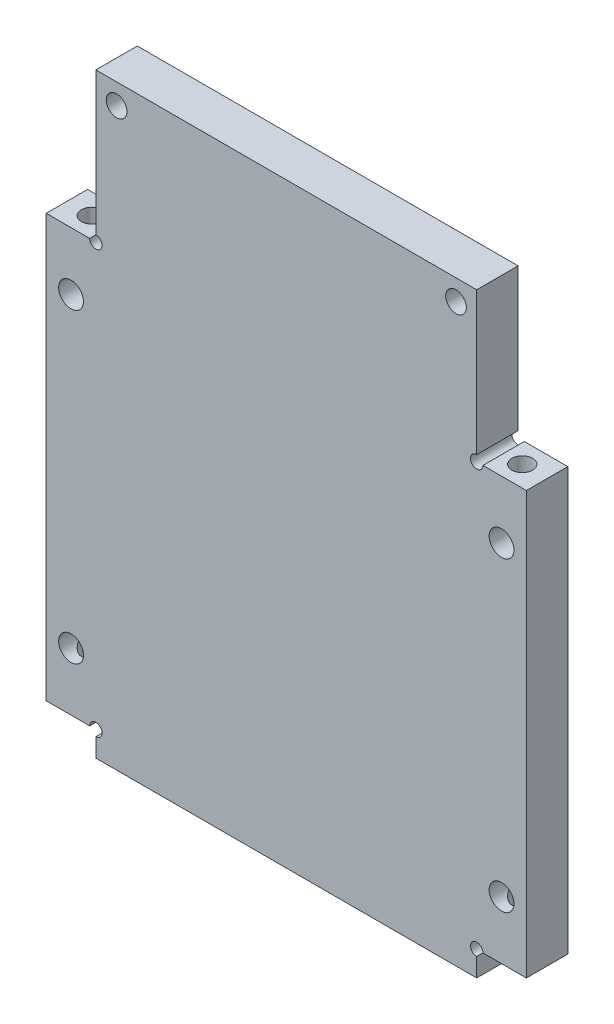
from build123d import *

# Parameters (mm, degrees)
EXTRUDE_1_DEPTH     = 5
SKETCH_3_R          = 1.25
CUT_EXTRUDE_2_DEPTH = 7.5
SKETCH_4_R          = 1.25
CUT_EXTRUDE_3_DEPTH = 76.013332148
SKETCH_5_R          = 0.75
CUT_EXTRUDE_4_DEPTH = 76.013332148
SKETCH_6_R          = 1.5
CUT_EXTRUDE_5_DEPTH = 76.013332148


with BuildPart() as part:
    # ｽｹｯﾁ1 → ﾎﾞｽ - 押し出し1 (new body)
    with BuildSketch(Plane.XY):
        Polygon((-29, 51), (-29, 0), (-23, 0), (-23, -3), (23, -3), (23, 0), (29, 0), (29, 51), (23, 51), (23, 69), (-23, 69), (-23, 51), align=None)
    extrude(amount=EXTRUDE_1_DEPTH)

    # ｽｹｯﾁ3 → ｶｯﾄ - 押し出し2 (cut)
    with BuildSketch(Plane(origin=(0, 51, 0), x_dir=(1, 0, 0), z_dir=(0, 1, 0))):
        with Locations(Location((-26, -2.5, 0), (0, 0, 270))):
            Circle(SKETCH_3_R)
        with Locations(Location((26, -2.5, 0), (0, 0, 270))):
            Circle(SKETCH_3_R)
    cut_extrude_2 = extrude(amount=-CUT_EXTRUDE_2_DEPTH, mode=Mode.SUBTRACT)

    # ﾐﾗｰ1: ｶｯﾄ - 押し出し2 across plane
    add(cut_extrude_2.mirror(Plane.ZX.offset(25.5)), mode=Mode.SUBTRACT)

    # ｽｹｯﾁ4 → ｶｯﾄ - 押し出し3 (cut, through all)
    with BuildSketch(Plane(origin=(0, 0, 0), x_dir=(-1, 0, 0), z_dir=(0, 0, -1))):
        with Locations((-20.5, 66.5)):
            Circle(SKETCH_4_R)
        with Locations((20.5, 66.5)):
            Circle(SKETCH_4_R)
    extrude(amount=-CUT_EXTRUDE_3_DEPTH, mode=Mode.SUBTRACT)

    # ｽｹｯﾁ5 → ｶｯﾄ - 押し出し4 (cut, through all)
    with BuildSketch(Plane(origin=(0, 0, 0), x_dir=(-1, 0, 0), z_dir=(0, 0, -1))):
        with Locations((-23, 0)):
            Circle(SKETCH_5_R)
        with Locations((23, 0)):
            Circle(SKETCH_5_R)
        with Locations((-23, 51)):
            Circle(SKETCH_5_R)
        with Locations((23, 51)):
            Circle(SKETCH_5_R)
    extrude(amount=-CUT_EXTRUDE_4_DEPTH, mode=Mode.SUBTRACT)

    # ｽｹｯﾁ6 → ｶｯﾄ - 押し出し5 (cut, through all)
    with BuildSketch(Plane(origin=(0, 0, 0), x_dir=(-1, 0, 0), z_dir=(0, 0, -1))):
        with Locations((-26, 44)):
            Circle(SKETCH_6_R)
        with Locations(Location((-26, 7, 0), (0, 0, 180))):
            Circle(SKETCH_6_R)
        with Locations((26, 7)):
            Circle(SKETCH_6_R)
        with Locations(Location((26, 44, 0), (0, 0, 180))):
            Circle(SKETCH_6_R)
    extrude(amount=-CUT_EXTRUDE_5_DEPTH, mode=Mode.SUBTRACT)


solid = part.part
